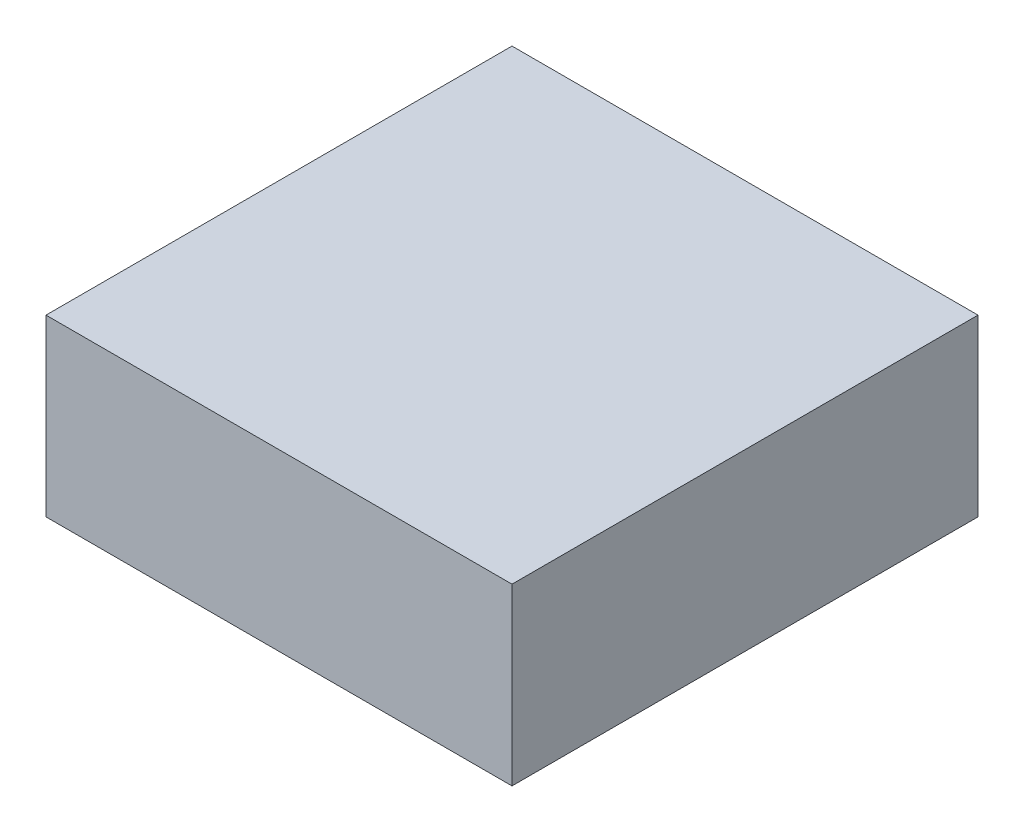
from build123d import *

# Parameters (mm, degrees)
SKETCH1_W           = 32
SKETCH1_H           = 32
BOSS_EXTRUDE1_DEPTH = 12


with BuildPart() as part:
    # Sketch1 → Boss-Extrude1 (new body)
    with BuildSketch(Plane(origin=(0, 0, 0), x_dir=(1, 0, 0), z_dir=(0, 1, 0))):
        Rectangle(SKETCH1_W, SKETCH1_H)
    extrude(amount=BOSS_EXTRUDE1_DEPTH)


solid = part.part
